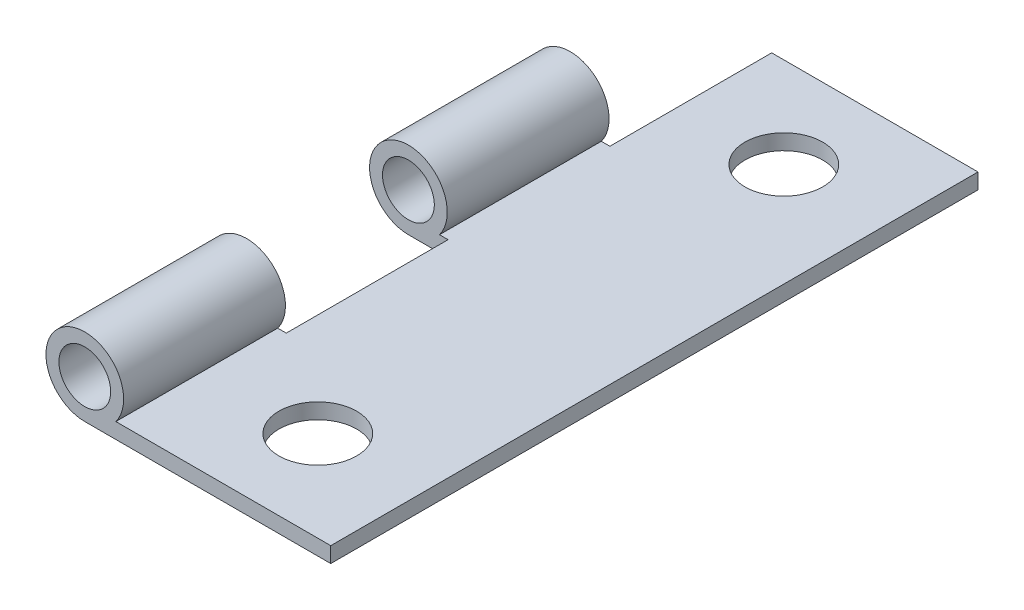
from build123d import *

# Parameters (mm, degrees)
SKETCH_2_R          = 1
EXTRUDE_1_DEPTH     = 12.5
SKETCH_3_W          = 3.539964401
SKETCH_3_H          = 6.25
SKETCH_3_W_2        = 3.996790544
CUT_EXTRUDE_1_DEPTH = 12.5
SKETCH_4_R          = 1.5
CUT_EXTRUDE_2_DEPTH = 10


with BuildPart() as part:
    # 草图2 → 凸台-拉伸1 (new, symmetric)
    with BuildSketch(Plane.XY):
        with BuildLine():
            Line((0, -1.5), (9.5, -1.5))
            Line((9.5, -1.5), (9.5, -0.9))
            Line((9.5, -0.9), (1.2, -0.9))
            ThreePointArc((1.2, -0.9), (-0.670820393, 1.341640786), (0, -1.5))
        make_face()
        Circle(SKETCH_2_R, mode=Mode.SUBTRACT)
    extrude(amount=EXTRUDE_1_DEPTH, both=True)

    # 草图3 → 切除-拉伸1 (cut, symmetric)
    with BuildSketch(Plane(origin=(0, -0.9, 0), x_dir=(1, 0, 0), z_dir=(0, 1, 0))):
        with Locations((-0.238476372, 9.375)):
            Rectangle(SKETCH_3_W, SKETCH_3_H)
        with Locations((-0.466889443, -3.125)):
            Rectangle(SKETCH_3_W_2, SKETCH_3_H)
    extrude(amount=CUT_EXTRUDE_1_DEPTH, both=True, mode=Mode.SUBTRACT)

    # 草图4 → 切除-拉伸2 (cut)
    with BuildSketch(Plane(origin=(0, -0.9, 0), x_dir=(1, 0, 0), z_dir=(0, 1, 0))):
        with Locations(Location((5.5, 9, 0), (0, 0, 180))):
            Circle(SKETCH_4_R)
        with Locations(Location((5.5, -9, 0), (0, 0, 180))):
            Circle(SKETCH_4_R)
    extrude(amount=-CUT_EXTRUDE_2_DEPTH, mode=Mode.SUBTRACT)


solid = part.part
